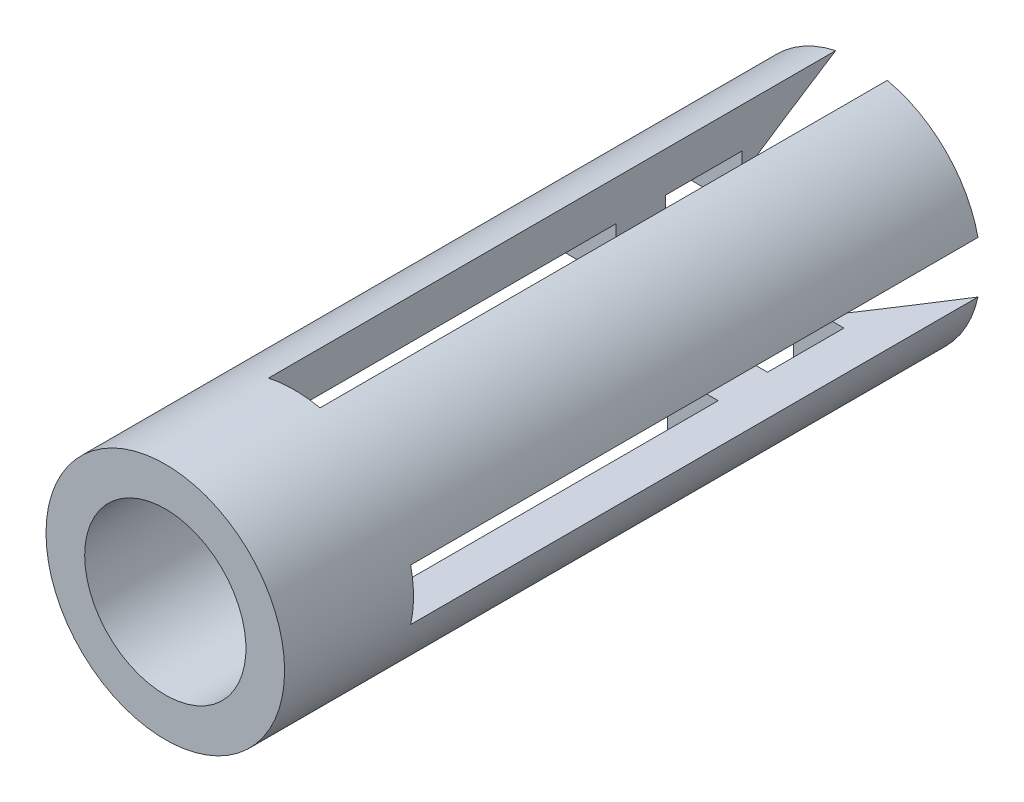
from build123d import *

# Parameters (mm, degrees)
CUT_EXTRUDE1_DEPTH      = 86.717666245
CUT_EXTRUDE1_DEPTH_BACK = 86.717666245
SKETCH7_W               = 5.08
SKETCH7_H               = 55.892291628
CUT_EXTRUDE2_DEPTH      = 86.717666245
CUT_EXTRUDE2_DEPTH_BACK = 86.717666245
SKETCH8_W               = 5.08
SKETCH8_H               = 55.892291628


with BuildPart() as part:
    # Sketch4 → Revolve1 (revolve)
    with BuildSketch(Plane.YZ, mode=Mode.PRIVATE) as revolve1_sk:
        Polygon((11.75385, 15.498209184), (11.75385, 84.090500812), (7.94385, 84.090500812), (7.94385, 37.139237028), (3.258679023, 37.139237028), (3.258679023, 32.283867455), (7.94385, 32.283867455), (7.94385, 24.752767455), (5.969, 24.752767455), align=None)
    revolve(revolve1_sk.sketch.rotate(Axis((0, 0, -23.885554531), (0, 0, 1)), 90), axis=Axis((0, 0, -23.885554531), (0, 0, 1)))

    # Sketch7 → Cut-Extrude1 (cut, two sides: drawn at the far end of the back side and taken through both)
    with BuildSketch(Plane.YZ.offset(-CUT_EXTRUDE1_DEPTH_BACK)):
        with Locations((0, 43.444354998)):
            Rectangle(SKETCH7_W, SKETCH7_H)
    extrude(amount=CUT_EXTRUDE1_DEPTH + CUT_EXTRUDE1_DEPTH_BACK, mode=Mode.SUBTRACT)

    # Sketch8 → Cut-Extrude2 (cut, two sides: drawn at the far end of the back side and taken through both)
    with BuildSketch(Plane(origin=(0, 0, 0), x_dir=(-1, 0, 0), z_dir=(0, 1, 0)).offset(-CUT_EXTRUDE2_DEPTH_BACK)):
        with Locations((0, 43.444354998)):
            Rectangle(SKETCH8_W, SKETCH8_H)
    extrude(amount=CUT_EXTRUDE2_DEPTH + CUT_EXTRUDE2_DEPTH_BACK, mode=Mode.SUBTRACT)


solid = part.part
